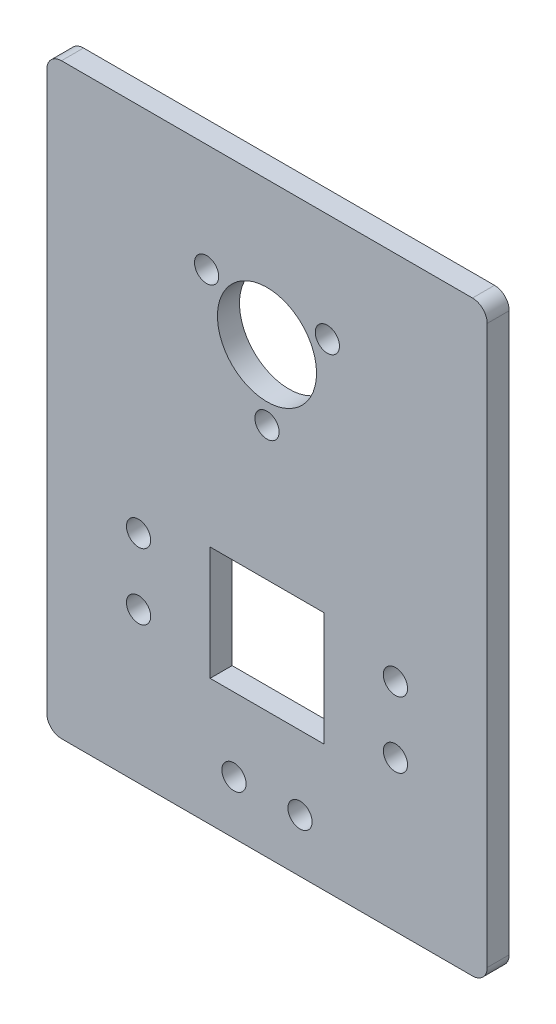
from build123d import *

# Parameters (mm, degrees)
SKETCH_1_W          = 60
SKETCH_1_H          = 90
EXTRUDE_1_DEPTH     = 3
SKETCH_2_R          = 1.65
CUT_EXTRUDE_1_DEPTH = 3
SKETCH_5_W          = 15.5
SKETCH_5_H          = 15.5
CUT_EXTRUDE_4_DEPTH = 1000
SKETCH_3_R          = 1.65
CUT_EXTRUDE_2_DEPTH = 3
SKETCH_4_R          = 6.75
CUT_EXTRUDE_3_DEPTH = 3
FILLET_1_R          = 2
SKETCH_6_W          = 69.11106811
SKETCH_6_H          = 12.862943276
CUT_EXTRUDE_5_DEPTH = 1000
FILLET_2_R          = 2
SKETCH_7_R          = 1.65
CUT_EXTRUDE_6_DEPTH = 1000


with BuildPart() as part:
    # 草图1 → 凸台-拉伸1 (new body)
    with BuildSketch(Plane.XY):
        Rectangle(SKETCH_1_W, SKETCH_1_H)
    extrude(amount=EXTRUDE_1_DEPTH)

    # 草图2 → 切除-拉伸1 (cut)
    with BuildSketch(Plane.XY.offset(3)):
        with Locations((0, 16)):
            Circle(SKETCH_2_R)
        with Locations((-8.227241336, 30.25)):
            Circle(SKETCH_2_R)
        with Locations((8.227241336, 30.25)):
            Circle(SKETCH_2_R)
    extrude(amount=-CUT_EXTRUDE_1_DEPTH, mode=Mode.SUBTRACT)

    # 草图5 → 切除-拉伸4 (cut)
    with BuildSketch(Plane.XY.offset(3)):
        with Locations((0, -10)):
            Rectangle(SKETCH_5_W, SKETCH_5_H)
    extrude(amount=-CUT_EXTRUDE_4_DEPTH, mode=Mode.SUBTRACT)

    # 草图3 → 切除-拉伸2 (cut)
    with BuildSketch(Plane.XY.offset(3)):
        with Locations((4.5, -27.75)):
            Circle(SKETCH_3_R)
        with Locations((-4.5, -27.75)):
            Circle(SKETCH_3_R)
    extrude(amount=-CUT_EXTRUDE_2_DEPTH, mode=Mode.SUBTRACT)

    # 草图4 → 切除-拉伸3 (cut)
    with BuildSketch(Plane.XY.offset(3)):
        with Locations((0, 25.5)):
            Circle(SKETCH_4_R)
    extrude(amount=-CUT_EXTRUDE_3_DEPTH, mode=Mode.SUBTRACT)

    # 圆角1
    fillet_1_edges = [part.edges().sort_by_distance(p)[0] for p in [
        (-30, 45, 1.5),
        (30, 45, 1.5),
    ]]
    fillet(fillet_1_edges, radius=FILLET_1_R)

    # 草图6 → 切除-拉伸5 (cut)
    with BuildSketch(Plane.XY.offset(3)):
        with Locations((0, -41.431471638)):
            Rectangle(SKETCH_6_W, SKETCH_6_H)
    extrude(amount=-CUT_EXTRUDE_5_DEPTH, mode=Mode.SUBTRACT)

    # 圆角2
    fillet_2_edges = [part.edges().sort_by_distance(p)[0] for p in [
        (30, -35, 1.5),
        (-30, -35, 1.5),
    ]]
    fillet(fillet_2_edges, radius=FILLET_2_R)

    # 草图7 → 切除-拉伸6 (cut)
    with BuildSketch(Plane.XY.offset(3)):
        with Locations((17.5, -5.5)):
            Circle(SKETCH_7_R)
        with Locations((17.5, -14.5)):
            Circle(SKETCH_7_R)
        with Locations((-17.5, -5.5)):
            Circle(SKETCH_7_R)
        with Locations((-17.5, -14.5)):
            Circle(SKETCH_7_R)
    extrude(amount=-CUT_EXTRUDE_6_DEPTH, mode=Mode.SUBTRACT)


solid = part.part
